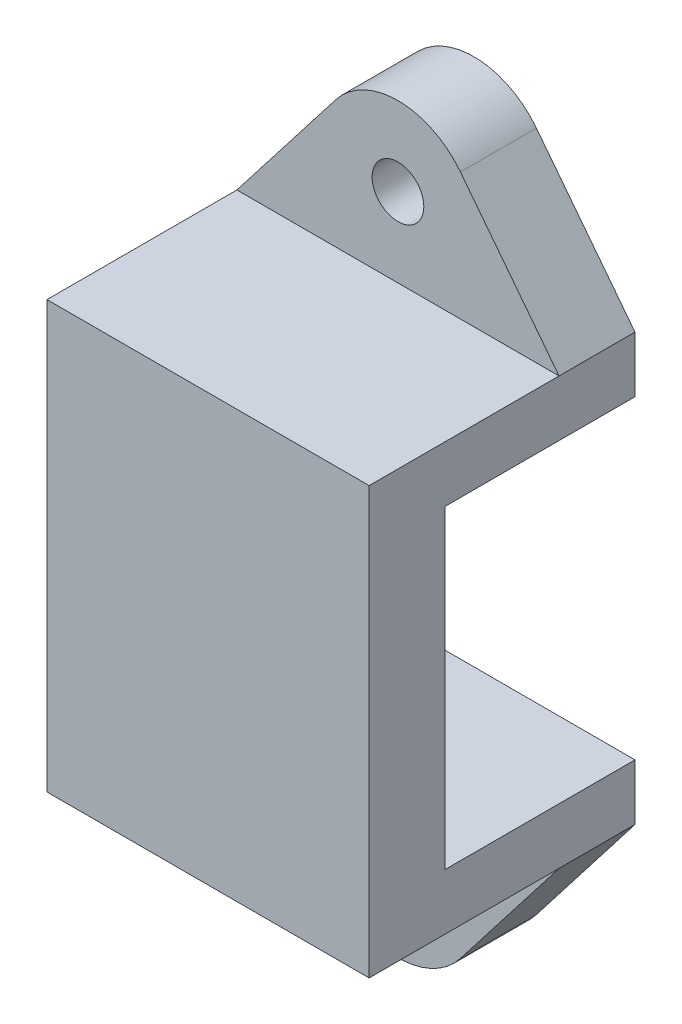
from build123d import *

# Parameters (mm, degrees)
SKETCH5_R             = 1.7
BOSS_EXTRUDE5_DEPTH   = 5
BOSS_EXTRUDE5_2_DEPTH = 5
SKETCH6_W             = 21.205551353
SKETCH6_H             = 3.684327219
BOSS_EXTRUDE6_DEPTH   = 7.5
SKETCH7_W             = 21.205551353
SKETCH7_H             = 28.068654438
BOSS_EXTRUDE7_DEPTH   = 5


with BuildPart() as part:
    # Sketch5 → Boss-Extrude5 (new body)
    with BuildSketch(Plane.XY):
        with BuildLine():
            Line((7.492385077, 44.529251739), (1, 36.146663352))
            Line((1, 36.146663352), (1, 32.462336133))
            Line((1, 32.462336133), (5.2, 32.462336133))
            Line((5.2, 32.462336133), (22.205551353, 32.462336133))
            Line((22.205551353, 32.462336133), (22.205551353, 36.146663352))
            Line((22.205551353, 36.146663352), (15.713166275, 44.529251739))
            ThreePointArc((15.713166275, 44.529251739), (11.602775676, 46.544776073), (7.492385077, 44.529251739))
        make_face()
        with Locations((11.602775676, 41.345719713)):
            Circle(SKETCH5_R, mode=Mode.SUBTRACT)
    extrude(amount=BOSS_EXTRUDE5_DEPTH)



with BuildPart() as body_2:
    # Sketch5 → Boss-Extrude5 2 (new body)
    with BuildSketch(Plane.XY):
        with BuildLine():
            Line((5.2, 11.762336133), (1, 11.762336133))
            Line((1, 11.762336133), (1, 8.078008914))
            Line((1, 8.078008914), (7.492385077, -0.304579472))
            ThreePointArc((7.492385077, -0.304579472), (11.602775676, -2.320103807), (15.713166275, -0.304579472))
            Line((15.713166275, -0.304579472), (22.205551353, 8.078008914))
            Line((22.205551353, 8.078008914), (22.205551353, 11.762336133))
            Line((22.205551353, 11.762336133), (5.2, 11.762336133))
        make_face()
        with Locations((11.602775676, 2.878952554)):
            Circle(SKETCH5_R, mode=Mode.SUBTRACT)
    extrude(amount=BOSS_EXTRUDE5_2_DEPTH)


with BuildPart() as part_1:
    add(part.part)

    add(body_2.part)  # Boss-Extrude6 merges body 2
    # Sketch6 → Boss-Extrude6 (add)
    with BuildSketch(Plane.XY.offset(5)):
        with Locations((11.602775677, 9.920172523)):
            Rectangle(SKETCH6_W, SKETCH6_H)
        with Locations((11.602775677, 34.304499742)):
            Rectangle(SKETCH6_W, SKETCH6_H)
    extrude(amount=BOSS_EXTRUDE6_DEPTH)

    # Sketch7 → Boss-Extrude7 (add)
    with BuildSketch(Plane.XY.offset(12.5)):
        with Locations((11.602775677, 22.112336133)):
            Rectangle(SKETCH7_W, SKETCH7_H)
    extrude(amount=BOSS_EXTRUDE7_DEPTH)


solid = part_1.part
